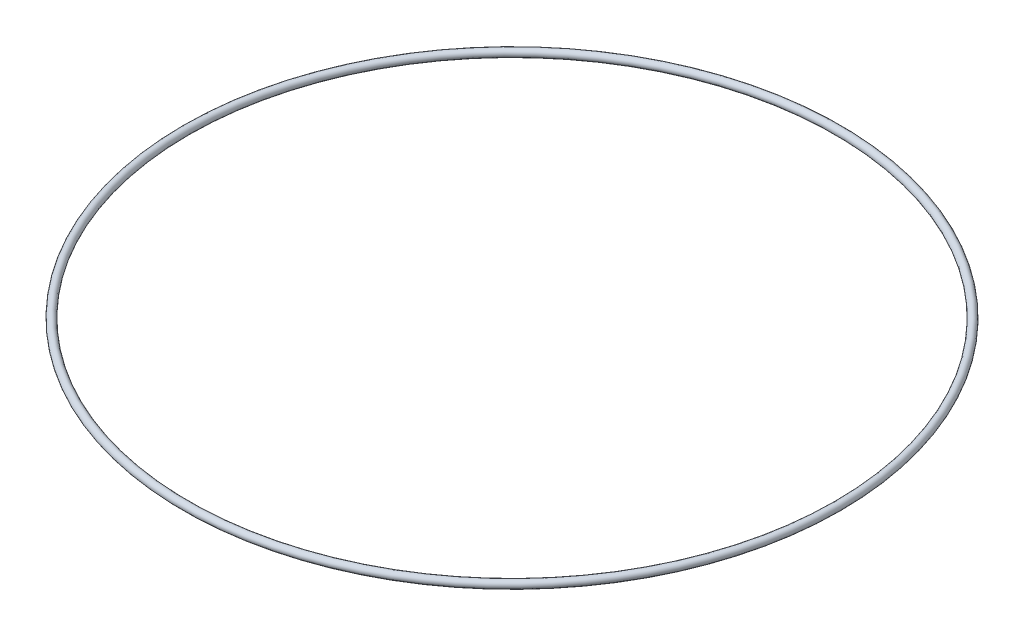
from build123d import *

# Parameters (mm, degrees)
SKETCH2_R = 0.889


with BuildPart() as part:
    # Sweep1: sweep along a path in Sketch3
    with BuildLine(Plane(origin=(0, 0, 0), x_dir=(1, 0, 0), z_dir=(0, 1, 0))) as sweep1_path:
        CenterArc((0, 0), 75, 0, 360)
    # Sketch2 → Sweep1 (sweep)
    with BuildSketch(Plane.XY):
        with Locations((75, 0)):
            Circle(SKETCH2_R)
    sweep(path=sweep1_path.line)


solid = part.part
